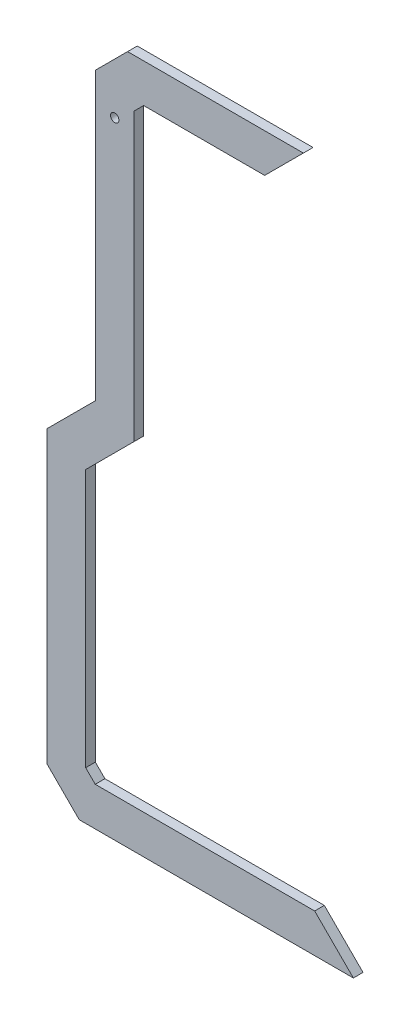
from build123d import *

# Parameters (mm, degrees)
SKETCH1_R      = 1.3
EXTRUDE1_DEPTH = 3


with BuildPart() as part:
    # Sketch1 → Extrude1 (new body)
    with BuildSketch(Plane.XY):
        Polygon((70, -179.753959847), (-15, -179.753959847), (-25, -169.753959847), (-25, -79.753959847), (-10, -64.753959847), (-10, 24.003545781), (0, 34.003545781), (54.5, 34.003545781), (42.5, 22.003545781), (4.970562749, 22.003545781), (2, 19.032983033), (2, -69.724522596), (-13, -84.724522596), (-13, -164.783397099), (-10.029437251, -167.753959847), (58, -167.753959847), align=None)
        with Locations((-4, 14.243545781)):
            Circle(SKETCH1_R, mode=Mode.SUBTRACT)
    extrude(amount=EXTRUDE1_DEPTH)


solid = part.part
